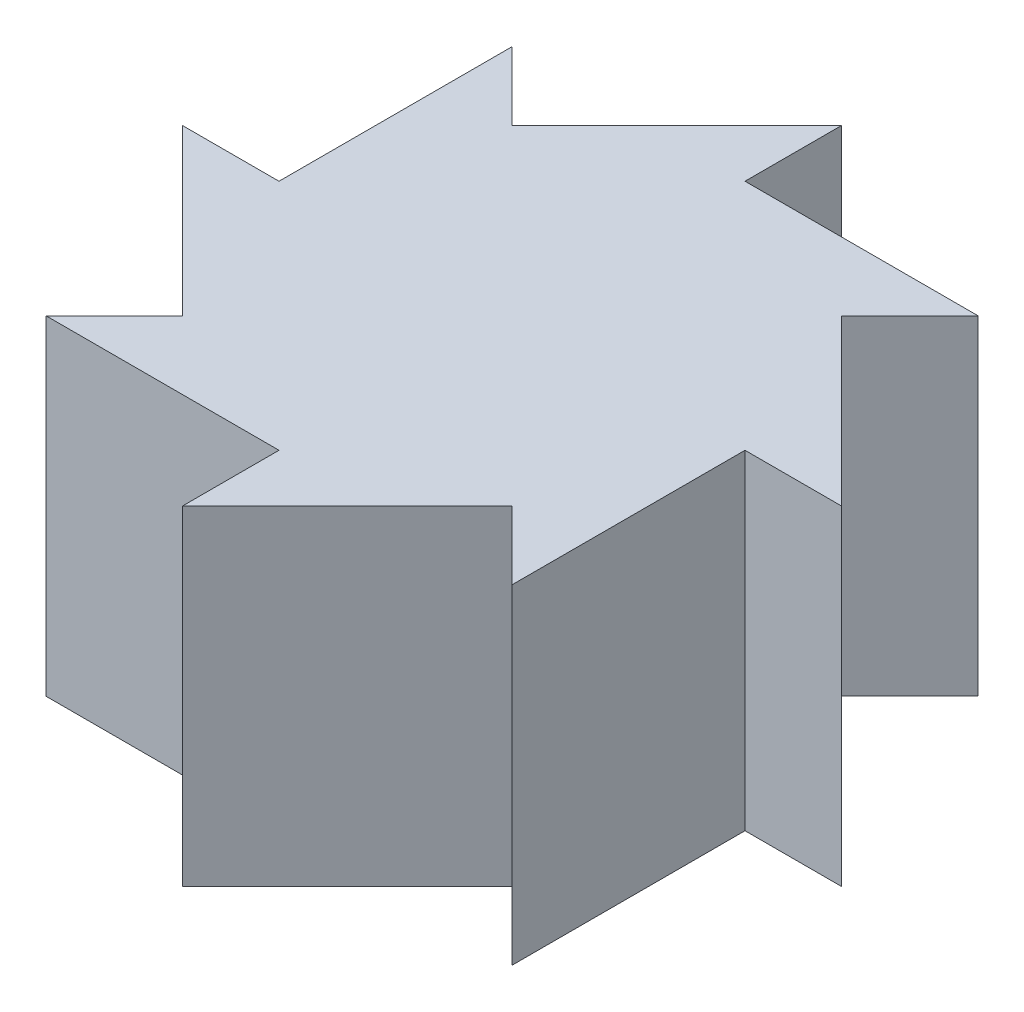
from build123d import *

# Parameters (mm, degrees)
SKETCH1_R           = 5
BOSS_EXTRUDE1_DEPTH = 5
CUT_EXTRUDE1_DEPTH  = 9.660254038
CIRPATTERN1_COUNT   = 8


with BuildPart() as part:
    # Sketch1 → Boss-Extrude1 (new body)
    with BuildSketch(Plane(origin=(0, 0, 0), x_dir=(1, 0, 0), z_dir=(0, 1, 0))):
        Circle(SKETCH1_R)
    extrude(amount=BOSS_EXTRUDE1_DEPTH)

    # Sketch2 → Cut-Extrude1 (cut, through all)
    with BuildSketch(Plane(origin=(0, 5, 0), x_dir=(1, 0, 0), z_dir=(0, 1, 0))):
        with BuildLine():
            Line((0, 5), (0, 3.535533906))
            Line((0, 3.535533906), (3.535533906, 3.535533906))
            ThreePointArc((3.535533906, 3.535533906), (1.913417162, 4.619397663), (0, 5))
        make_face()
    cut_extrude1 = extrude(amount=-CUT_EXTRUDE1_DEPTH, mode=Mode.SUBTRACT)

    # CirPattern1: Cut-Extrude1 ×8 about axis
    cirpattern1_axis = Axis((0, 5, 0), (0, 1, 0))
    for i in range(1, CIRPATTERN1_COUNT):
        add(cut_extrude1.rotate(cirpattern1_axis, i * 360 / CIRPATTERN1_COUNT), mode=Mode.SUBTRACT)


solid = part.part
